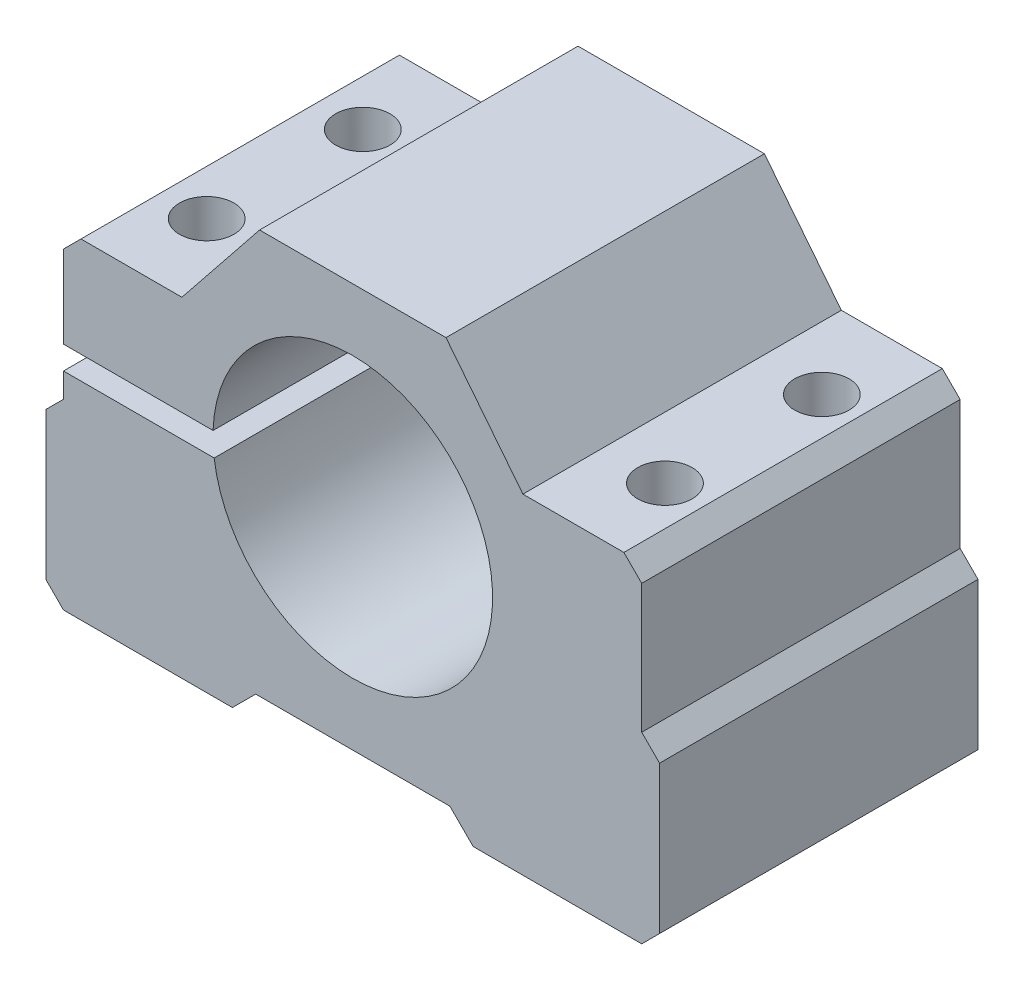
from build123d import *

# Parameters (mm, degrees)
EXTRUDE_5_DEPTH     = 41
SKETCH_2_R          = 3.5
CUT_EXTRUDE_3_DEPTH = 50


with BuildPart() as part:
    # 草图1 → 凸台-拉伸5 (new body)
    with BuildSketch(Plane.XY):
        with BuildLine():
            ThreePointArc((21.653756169, 26.652324316), (57.479756353, 29.853440976), (21.511621785, 29.646721888))
            Line((21.511621785, 29.646721888), (2.250174694, 29.646721888))
            Line((2.250174694, 29.646721888), (2.250174694, 40.249825306))
            Line((2.250174694, 40.249825306), (4.500349388, 42.5))
            Line((4.500349388, 42.5), (17.500349388, 42.5))
            Line((17.500349388, 42.5), (27.5, 55))
            Line((27.5, 55), (51.5, 55))
            Line((51.5, 55), (61.4058809, 42.5))
            Line((61.4058809, 42.5), (74.4058809, 42.5))
            Line((74.4058809, 42.5), (76.70294045, 40.20294045))
            Line((76.70294045, 40.20294045), (76.70294045, 23.5941191))
            Line((76.70294045, 23.5941191), (79, 21.29705955))
            Line((79, 21.29705955), (79, 2.29705955))
            Line((79, 2.29705955), (76.70294045, 0))
            Line((76.70294045, 0), (55, 0))
            Line((55, 0), (52, 3))
            Line((52, 3), (27, 3))
            Line((27, 3), (24, 0))
            Line((24, 0), (2.250174694, 0))
            Line((2.250174694, 0), (0, 2.250174694))
            Line((0, 2.250174694), (0, 21.250174694))
            Line((0, 21.250174694), (2.250174694, 23.500349388))
            Line((2.250174694, 23.500349388), (2.250174694, 26.652324316))
            Line((2.250174694, 26.652324316), (21.653756169, 26.652324316))
        make_face()
    extrude(amount=EXTRUDE_5_DEPTH)

    # 草图2 → 切除-拉伸3 (cut)
    with BuildSketch(Plane(origin=(0, 0, 0), x_dir=(-1, 0, 0), z_dir=(0, -1, 0))):
        with Locations(Location((-10.435250124, -10.64238292, 0), (0, 0, 90))):
            Circle(SKETCH_2_R)
        with Locations(Location((-10.331990941, -30.64238292, 0), (0, 0, 90))):
            Circle(SKETCH_2_R)
        with Locations(Location((-69.331990941, -30.64238292, 0), (0, 0, 90))):
            Circle(SKETCH_2_R)
        with Locations(Location((-69.538509307, -10.64238292, 0), (0, 0, 90))):
            Circle(SKETCH_2_R)
    extrude(amount=-CUT_EXTRUDE_3_DEPTH, mode=Mode.SUBTRACT)


solid = part.part
